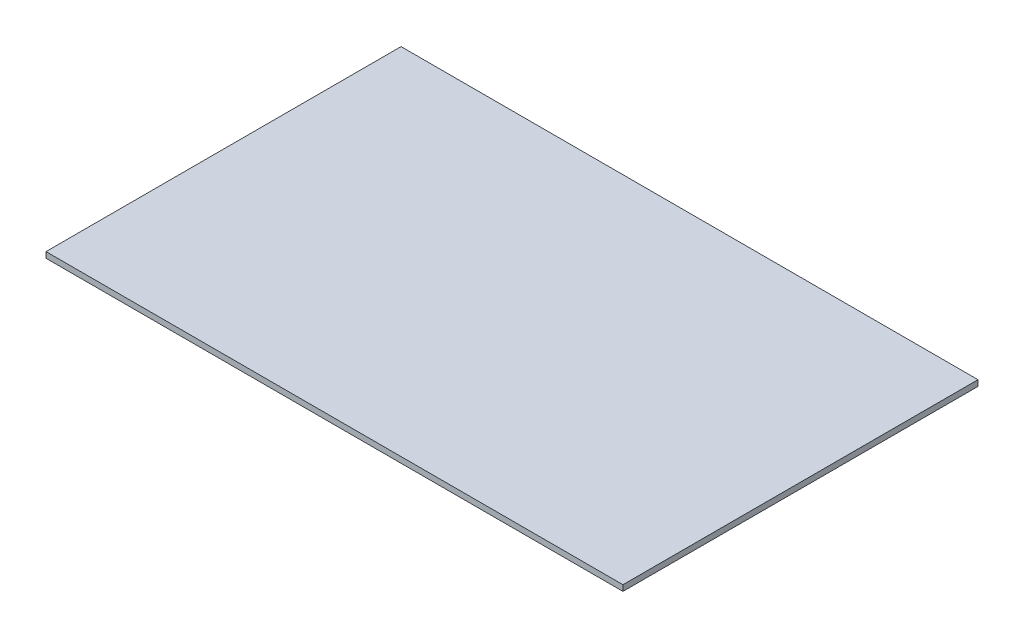
from build123d import *

# Parameters (mm, degrees)
SKETCH1_W           = 990.6
SKETCH1_H           = 609.6
BOSS_EXTRUDE1_DEPTH = 10


with BuildPart() as part:
    # Sketch1 → Boss-Extrude1 (new body)
    with BuildSketch(Plane(origin=(0, 0, 0), x_dir=(1, 0, 0), z_dir=(0, 1, 0))):
        Rectangle(SKETCH1_W, SKETCH1_H)
    extrude(amount=BOSS_EXTRUDE1_DEPTH)


solid = part.part
